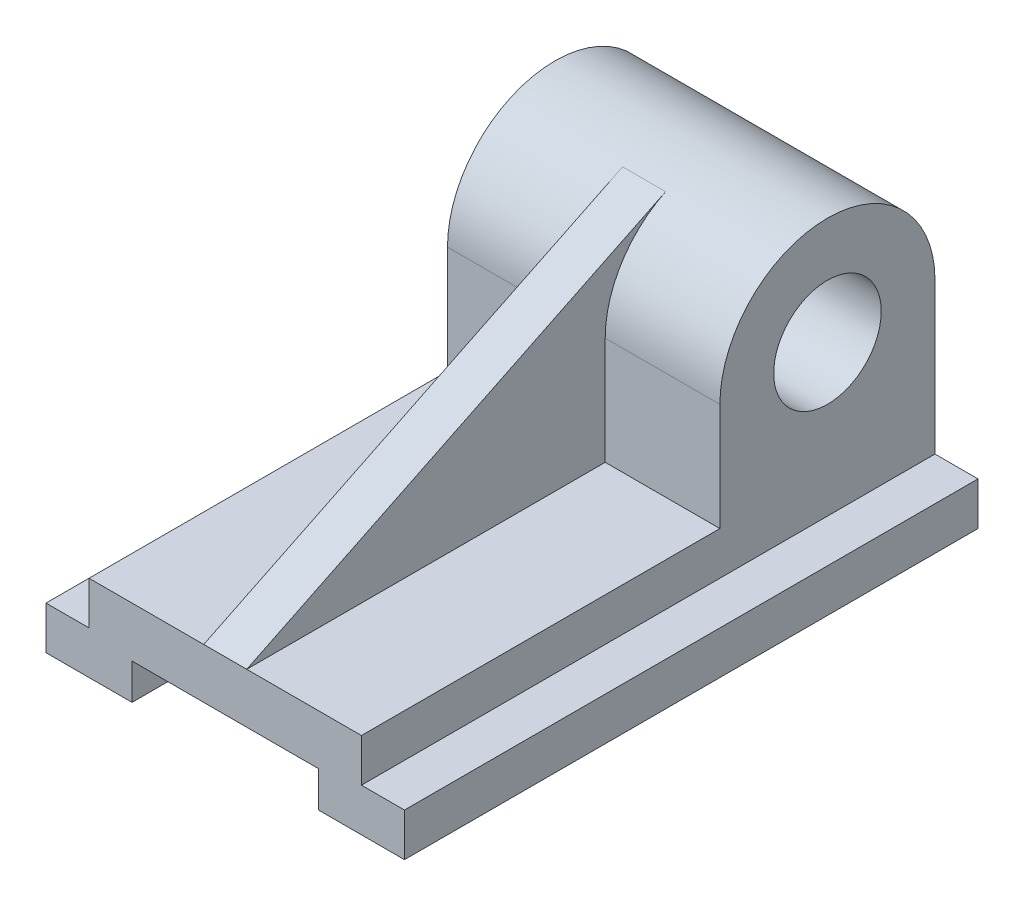
from build123d import *

# Parameters (mm, degrees)
SKETCH1_W           = 100
SKETCH1_H           = 24
BOSS_EXTRUDE1_DEPTH = 160
SKETCH2_W           = 52
SKETCH2_H           = 10
CUT_EXTRUDE1_DEPTH  = 169.059513268
SKETCH3_W           = 12
SKETCH3_H           = 12
CUT_EXTRUDE2_DEPTH  = 169.059513268
SKETCH4_W           = 76
SKETCH4_H           = 60
BOSS_EXTRUDE3_DEPTH = 60
FILLET2_RADIUS      = 30
FILLET2_LENGTH      = 76
SKETCH6_R           = 15
CUT_EXTRUDE3_DEPTH  = 197.285506342
RIB3_REACH          = 184.439
SKETCH9_WALL_W      = 496.878018
SKETCH9_WALL_H      = 12


with BuildPart() as part:
    # Sketch1 → Boss-Extrude1 (new body)
    with BuildSketch(Plane.XY):
        Rectangle(SKETCH1_W, SKETCH1_H)
    extrude(amount=BOSS_EXTRUDE1_DEPTH)

    # Sketch2 → Cut-Extrude1 (cut, through all)
    with BuildSketch(Plane.XY.offset(160)):
        with Locations((0, -7)):
            Rectangle(SKETCH2_W, SKETCH2_H)
    extrude(amount=-CUT_EXTRUDE1_DEPTH, mode=Mode.SUBTRACT)

    # Sketch3 → Cut-Extrude2 (cut, through all)
    with BuildSketch(Plane.XY.offset(160)):
        with Locations((44, 6)):
            Rectangle(SKETCH3_W, SKETCH3_H)
    cut_extrude2 = extrude(amount=-CUT_EXTRUDE2_DEPTH, mode=Mode.SUBTRACT)

    # Mirror1: Cut-Extrude2 across plane
    add(cut_extrude2.mirror(Plane(origin=(0, 0, 0), x_dir=(0, 0, 1), z_dir=(1, 0, 0))), mode=Mode.SUBTRACT)

    # Sketch4 → Boss-Extrude3 (add)
    with BuildSketch(Plane(origin=(0, 12, 0), x_dir=(1, 0, 0), z_dir=(0, 1, 0))):
        with Locations((0, -30)):
            Rectangle(SKETCH4_W, SKETCH4_H)
    extrude(amount=BOSS_EXTRUDE3_DEPTH)

    # Fillet2: full round fillet: the end face becomes a half cylinder, R = half its width
    fillet2_face = Plane((0, 72, 30), x_dir=(-1, 0, 0), z_dir=(0, 1, 0))  # on the end face: x along it, z out of the body
    fillet2_slab = fillet2_face.offset(-FILLET2_RADIUS / 2) * Box(FILLET2_LENGTH, 2 * FILLET2_RADIUS, FILLET2_RADIUS, mode=Mode.PRIVATE)  # the body's end, R deep
    fillet2_round = Plane((0, 42, 30), x_dir=(0, 1, 0), z_dir=(-1, 0, 0)) * Cylinder(FILLET2_RADIUS, FILLET2_LENGTH, mode=Mode.PRIVATE)  # its axis R under the face
    add(fillet2_slab - fillet2_round, mode=Mode.SUBTRACT)

    # Sketch6 → Cut-Extrude3 (cut, through all)
    with BuildSketch(Plane(origin=(38, 0, 0), x_dir=(0, 0, -1), z_dir=(1, 0, 0))):
        with Locations((-30, 42)):
            Circle(SKETCH6_R)
    extrude(amount=-CUT_EXTRUDE3_DEPTH, mode=Mode.SUBTRACT)

    # Sketch9 wall → Rib3 (add, up to next)
    with BuildSketch(Plane(origin=(0, 40.483136466, 101.573053404), x_dir=(0, 0.43820224719, -0.898876404495), z_dir=(0, 0.898876404495, 0.43820224719)), mode=Mode.PRIVATE) as rib3_sk1:
        Rectangle(SKETCH9_WALL_W, SKETCH9_WALL_H)
    rib3_tool1 = extrude(rib3_sk1.sketch, amount=-RIB3_REACH, mode=Mode.PRIVATE) - part.part
    add(rib3_tool1.solids().sort_by_distance((0, 40.483136466, 101.573053404))[0])


solid = part.part
